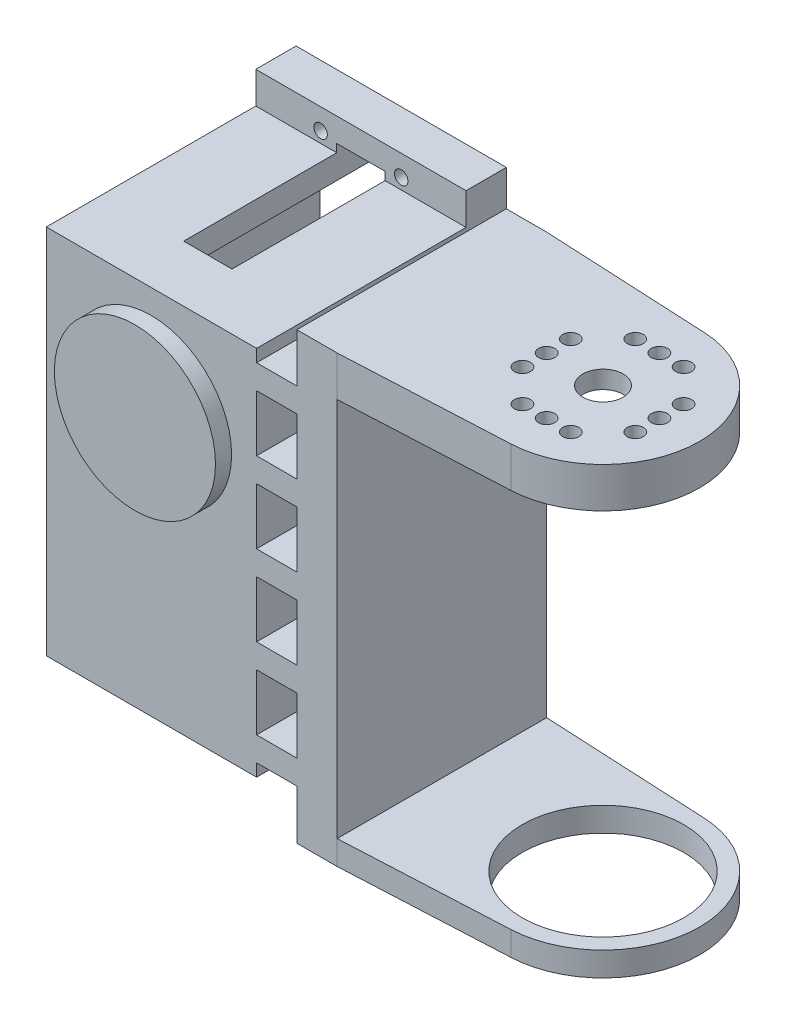
from build123d import *

# Parameters (mm, degrees)
SKETCH1_W           = 26.1
SKETCH1_H           = 46.1
SKETCH1_W_2         = 20.1
SKETCH1_H_2         = 40.1
BOSS_EXTRUDE1_DEPTH = 31
SKETCH2_W           = 26.1
SKETCH2_H           = 46.1
BOSS_EXTRUDE2_DEPTH = 3
SKETCH3_R           = 10
BOSS_EXTRUDE3_DEPTH = 2
SKETCH4_W           = 26.1
SKETCH4_H           = 3.95
SKETCH4_R           = 0.836516838
BOSS_EXTRUDE4_DEPTH = 5
SKETCH5_W           = 26
SKETCH5_H           = 3
BOSS_EXTRUDE5_DEPTH = 5
SKETCH7_W           = 26
SKETCH7_H           = 55.2
BOSS_EXTRUDE6_DEPTH = 5
BOSS_EXTRUDE7_DEPTH = 55.2
SKETCH9_R           = 2.5
SKETCH9_R_2         = 1
CUT_EXTRUDE1_DEPTH  = 13.2
SKETCH10_R          = 10.025
CUT_EXTRUDE2_DEPTH  = 13.2
SKETCH11_W          = 37.335387761
SKETCH11_H          = 47.2
CUT_EXTRUDE3_DEPTH  = 43.2
SKETCH12_R          = 10.025
CUT_EXTRUDE4_DEPTH  = 2.8
SKETCH13_W          = 6
SKETCH13_H          = 4
CUT_EXTRUDE5_DEPTH  = 24


with BuildPart() as part:
    # Sketch1 → Boss-Extrude1 (new body)
    with BuildSketch(Plane.XY):
        Rectangle(SKETCH1_W, SKETCH1_H)
        Rectangle(SKETCH1_W_2, SKETCH1_H_2, mode=Mode.SUBTRACT)
    extrude(amount=BOSS_EXTRUDE1_DEPTH)

    # Sketch2 → Boss-Extrude2 (add)
    with BuildSketch(Plane.XY.offset(31)):
        Rectangle(SKETCH2_W, SKETCH2_H)
    extrude(amount=-BOSS_EXTRUDE2_DEPTH)

    # Sketch3 → Boss-Extrude3 (add)
    with BuildSketch(Plane.XY.offset(31)):
        with Locations((-0.05, 10.05)):
            Circle(SKETCH3_R)
    extrude(amount=BOSS_EXTRUDE3_DEPTH)

    # Sketch4 → Boss-Extrude4 (add)
    with BuildSketch(Plane(origin=(0, 0, 0), x_dir=(-1, 0, 0), z_dir=(0, 0, -1))):
        with Locations((0, 25.025)):
            Rectangle(SKETCH4_W, SKETCH4_H)
        with Locations((-5, 24.4)):
            Circle(SKETCH4_R, mode=Mode.SUBTRACT)
        with Locations((5, 24.4)):
            Circle(SKETCH4_R, mode=Mode.SUBTRACT)
    boss_extrude4 = extrude(amount=-BOSS_EXTRUDE4_DEPTH)

    # Mirror1: Boss-Extrude4 across plane
    add(boss_extrude4.mirror(Plane.ZX))

    # Sketch5 → Boss-Extrude5 (add)
    with BuildSketch(Plane(origin=(13.05, 0, 0), x_dir=(0, 0, -1), z_dir=(1, 0, 0))):
        with Locations((-18, 20)):
            Rectangle(SKETCH5_W, SKETCH5_H)
        with Locations((-18, 10)):
            Rectangle(SKETCH5_W, SKETCH5_H)
        with Locations((-18, 0)):
            Rectangle(SKETCH5_W, SKETCH5_H)
        with Locations((-18, -10)):
            Rectangle(SKETCH5_W, SKETCH5_H)
        with Locations((-18, -20)):
            Rectangle(SKETCH5_W, SKETCH5_H)
    extrude(amount=BOSS_EXTRUDE5_DEPTH)

    # Sketch7 → Boss-Extrude6 (add)
    with BuildSketch(Plane(origin=(18.05, 0, 0), x_dir=(0, 0, -1), z_dir=(1, 0, 0))):
        with Locations((-18, -0.05)):
            Rectangle(SKETCH7_W, SKETCH7_H)
    extrude(amount=BOSS_EXTRUDE6_DEPTH)

    # Sketch8 → Boss-Extrude7 (add)
    with BuildSketch(Plane(origin=(0, 27.55, 0), x_dir=(1, 0, 0), z_dir=(0, 1, 0))):
        with BuildLine():
            Line((43.640549012, -6.014539981), (23.05, -5))
            Line((23.05, -5), (23.05, -31))
            Line((23.05, -31), (43.640549012, -29.985460019))
            ThreePointArc((43.640549012, -29.985460019), (55.05, -18), (43.640549012, -6.014539981))
        make_face()
    extrude(amount=-BOSS_EXTRUDE7_DEPTH)

    # Sketch9 → Cut-Extrude1 (cut)
    with BuildSketch(Plane(origin=(0, 27.55, 0), x_dir=(1, 0, 0), z_dir=(0, 1, 0))):
        with Locations(Location((43.05, -18, 0), (0, 0, 270))):
            Circle(SKETCH9_R)
        with Locations(Location((50.05, -15, 0), (0, 0, 270))):
            Circle(SKETCH9_R_2)
        with Locations(Location((50.05, -18, 0), (0, 0, 270))):
            Circle(SKETCH9_R_2)
        with Locations(Location((50.05, -21, 0), (0, 0, 270))):
            Circle(SKETCH9_R_2)
        with Locations(Location((46.05, -25, 0), (0, 0, 270))):
            Circle(SKETCH9_R_2)
        with Locations(Location((43.05, -25, 0), (0, 0, 270))):
            Circle(SKETCH9_R_2)
        with Locations(Location((40.05, -25, 0), (0, 0, 270))):
            Circle(SKETCH9_R_2)
        with Locations(Location((36.05, -21, 0), (0, 0, 270))):
            Circle(SKETCH9_R_2)
        with Locations(Location((36.05, -18, 0), (0, 0, 270))):
            Circle(SKETCH9_R_2)
        with Locations(Location((36.05, -15, 0), (0, 0, 270))):
            Circle(SKETCH9_R_2)
        with Locations(Location((40.05, -11, 0), (0, 0, 270))):
            Circle(SKETCH9_R_2)
        with Locations(Location((43.05, -11, 0), (0, 0, 270))):
            Circle(SKETCH9_R_2)
        with Locations(Location((46.05, -11, 0), (0, 0, 270))):
            Circle(SKETCH9_R_2)
    extrude(amount=-CUT_EXTRUDE1_DEPTH, mode=Mode.SUBTRACT)

    # Sketch10 → Cut-Extrude2 (cut)
    with BuildSketch(Plane.XZ.offset(27.65)):
        with Locations(Location((43.05, 18, 0), (0, 0, 270))):
            Circle(SKETCH10_R)
    extrude(amount=-CUT_EXTRUDE2_DEPTH, mode=Mode.SUBTRACT)

    # Sketch11 → Cut-Extrude3 (cut)
    with BuildSketch(Plane(origin=(0, 0, 5), x_dir=(-1, 0, 0), z_dir=(0, 0, -1))):
        with Locations((-41.717693881, -1.05)):
            Rectangle(SKETCH11_W, SKETCH11_H)
    extrude(amount=-CUT_EXTRUDE3_DEPTH, mode=Mode.SUBTRACT)

    # Sketch12 → Cut-Extrude4 (cut)
    with BuildSketch(Plane.XZ.offset(-22.55)):
        with Locations(Location((43.05, 18, 0), (0, 0, 270))):
            Circle(SKETCH12_R)
    extrude(amount=-CUT_EXTRUDE4_DEPTH, mode=Mode.SUBTRACT)

    # Sketch13 → Cut-Extrude5 (cut)
    with BuildSketch(Plane(origin=(0, 0, 0), x_dir=(-1, 0, 0), z_dir=(0, 0, -1))):
        with Locations((0, 22.05)):
            Rectangle(SKETCH13_W, SKETCH13_H)
    extrude(amount=-CUT_EXTRUDE5_DEPTH, mode=Mode.SUBTRACT)


solid = part.part
